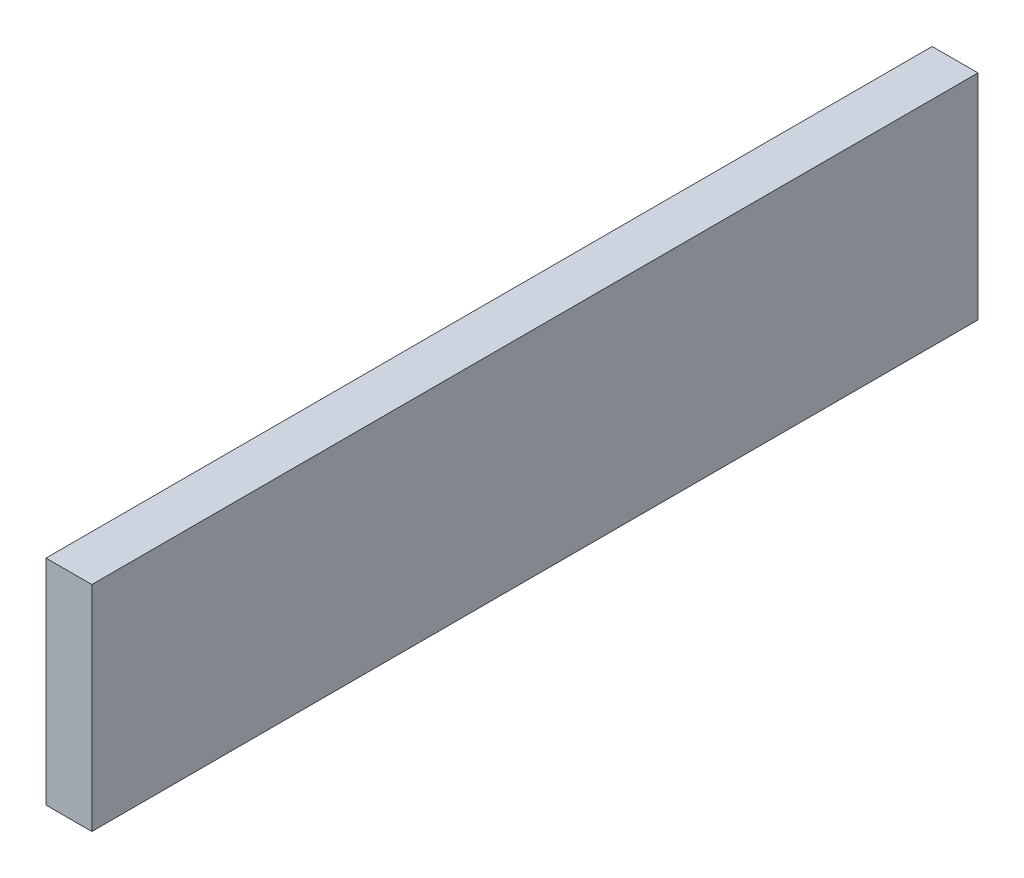
from build123d import *

# Parameters (mm, degrees)
ESQUISSE1_W        = 30
ESQUISSE1_H        = 140
BOSS_EXTRU_1_DEPTH = 580


with BuildPart() as part:
    # Esquisse1 → Boss.-Extru.1 (new body)
    with BuildSketch(Plane.XY):
        with Locations((365, 100)):
            Rectangle(ESQUISSE1_W, ESQUISSE1_H)
    extrude(amount=BOSS_EXTRU_1_DEPTH)


solid = part.part
